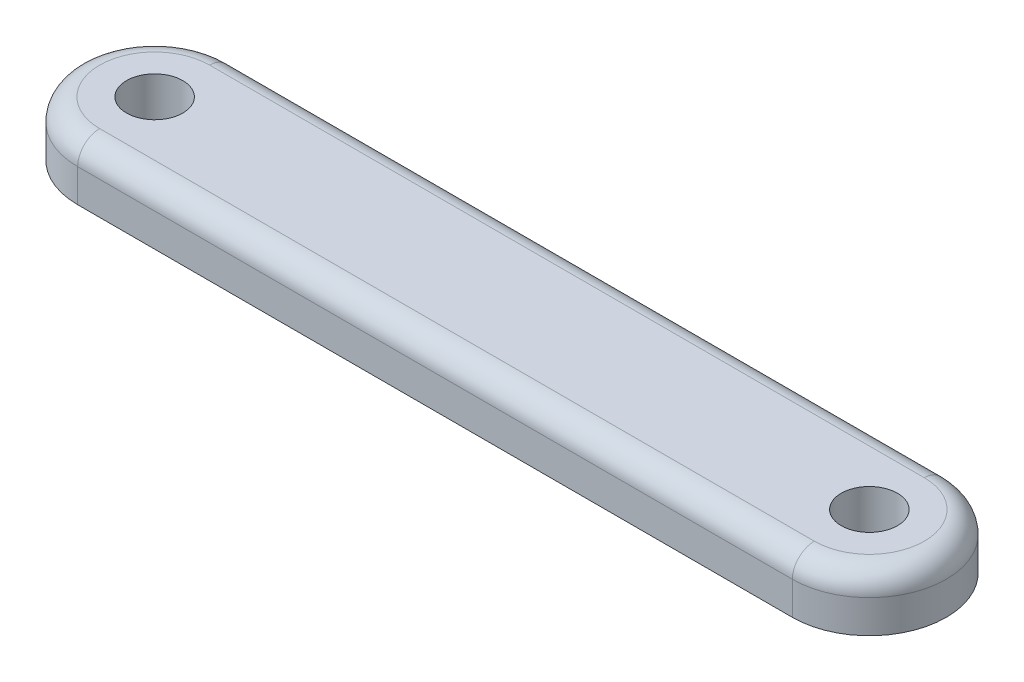
from build123d import *

# Parameters (mm, degrees)
SKETCH1_R           = 1.3
BOSS_EXTRUDE1_DEPTH = 2.54
FILLET1_R           = 1.016


with BuildPart() as part:
    # Sketch1 → Boss-Extrude1 (new body)
    with BuildSketch(Plane(origin=(0, 0, 0), x_dir=(1, 0, 0), z_dir=(0, 1, 0))):
        with BuildLine():
            Line((0, 3.556), (33.02, 3.556))
            ThreePointArc((33.02, 3.556), (36.576, 0), (33.02, -3.556))
            Line((33.02, -3.556), (0, -3.556))
            ThreePointArc((0, -3.556), (-3.556, 0), (0, 3.556))
        make_face()
        with Locations(Location((0, 0, 0), (0, 0, 270))):
            Circle(SKETCH1_R, mode=Mode.SUBTRACT)
        with Locations(Location((33.02, 0, 0), (0, 0, 270))):
            Circle(SKETCH1_R, mode=Mode.SUBTRACT)
    extrude(amount=BOSS_EXTRUDE1_DEPTH)

    # Fillet1
    fillet1_edges = [part.edges().sort_by_distance(p)[0] for p in [
        (36.576, 2.54, 0),
        (16.51, 2.54, -3.556),
        (-3.556, 2.54, 0),
        (16.51, 2.54, 3.556),
    ]]
    fillet(fillet1_edges, radius=FILLET1_R)


solid = part.part
